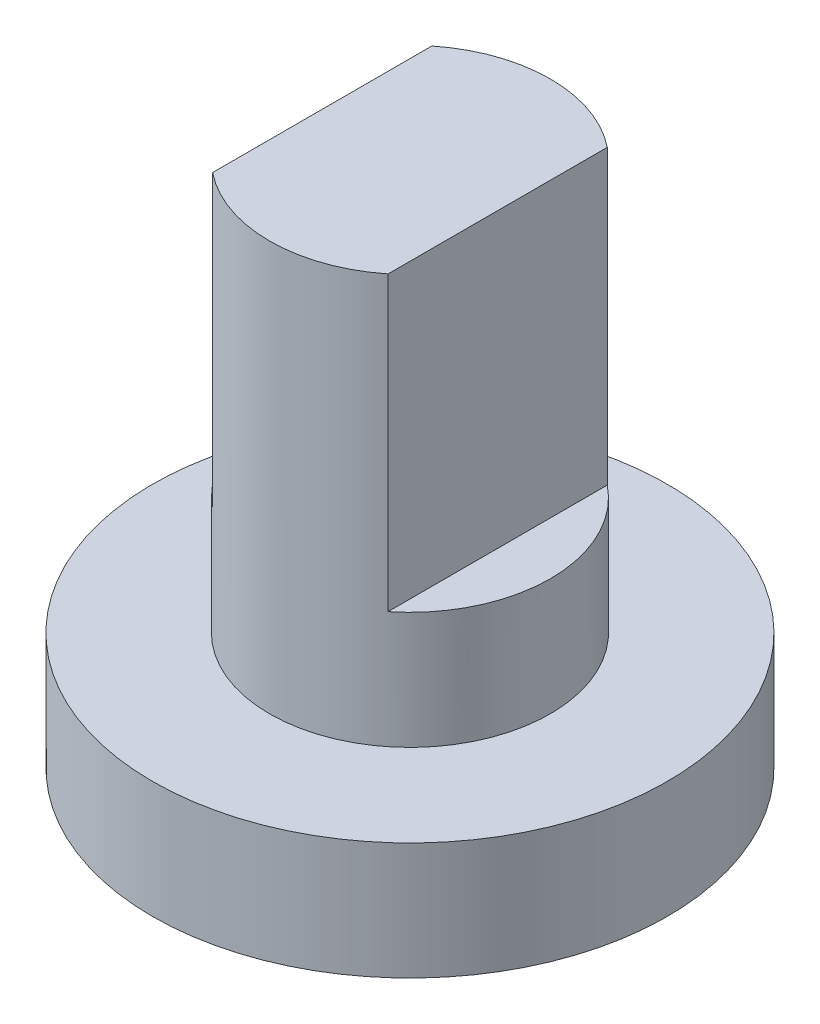
from build123d import *

# Parameters (mm, degrees)
SKETCH1_R           = 4.4
BOSS_EXTRUDE1_DEPTH = 2
SKETCH2_R           = 2.4
BOSS_EXTRUDE2_DEPTH = 2
SKETCH3_W           = 3
SKETCH3_H           = 3
BOSS_EXTRUDE3_DEPTH = 5


with BuildPart() as part:
    # Sketch1 → Boss-Extrude1 (new body)
    with BuildSketch(Plane(origin=(0, 0, 0), x_dir=(1, 0, 0), z_dir=(0, 1, 0))):
        with Locations(Location((0, 0, 0), (0, 0, 270))):
            Circle(SKETCH1_R)
    extrude(amount=BOSS_EXTRUDE1_DEPTH)

    # Sketch2 → Boss-Extrude2 (add)
    with BuildSketch(Plane(origin=(0, 2, 0), x_dir=(1, 0, 0), z_dir=(0, 1, 0))):
        with Locations(Location((0, 0, 0), (0, 0, 270))):
            Circle(SKETCH2_R)
    extrude(amount=BOSS_EXTRUDE2_DEPTH)

    # Sketch3 → Boss-Extrude3 (add)
    with BuildSketch(Plane(origin=(0, 4, 0), x_dir=(1, 0, 0), z_dir=(0, 1, 0))):
        with BuildLine():
            ThreePointArc((1.5, 1.8734994), (0, 2.4), (-1.5, 1.8734994))
            Line((-1.5, 1.8734994), (-1.5, 1.5))
            Line((-1.5, 1.5), (1.5, 1.5))
            Line((1.5, 1.5), (1.5, 1.8734994))
        make_face()
        Rectangle(SKETCH3_W, SKETCH3_H)
        with BuildLine():
            Line((1.5, -1.5), (-1.5, -1.5))
            Line((-1.5, -1.5), (-1.5, -1.8734994))
            ThreePointArc((-1.5, -1.8734994), (0, -2.4), (1.5, -1.8734994))
            Line((1.5, -1.8734994), (1.5, -1.5))
        make_face()
    extrude(amount=BOSS_EXTRUDE3_DEPTH)


solid = part.part
